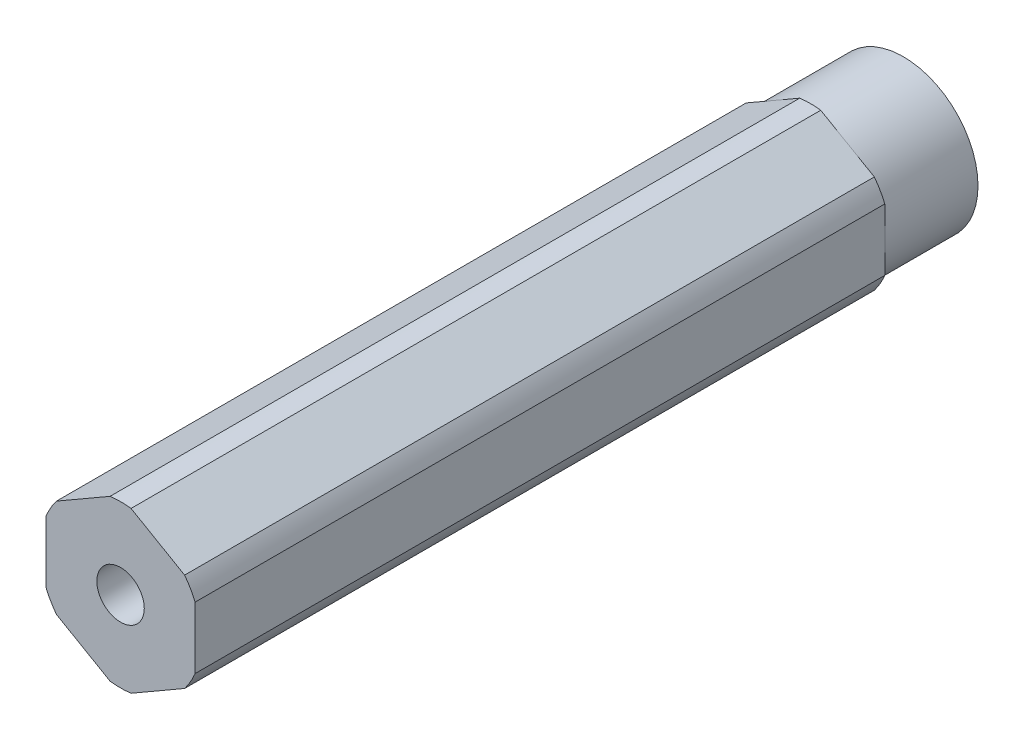
from build123d import *

# Parameters (mm, degrees)
BOSS_EXTRUDE1_DEPTH                  = 33.3375
SKETCH3_R                            = 2.0193
CUT_EXTRUDE1_DEPTH                   = 68.328625042
CUT_EXTRUDE3_START                   = -7.9375
SKETCH8_R                            = 6.875
SKETCH8_R_2                          = 6.35
CUT_EXTRUDE3_DEPTH                   = 7.9375
F_10_32_TAPPED_HOLE1_D               = 4.0386
F_10_32_TAPPED_HOLE1_DEPTH           = 12.02944
F_10_32_TAPPED_HOLE1_TIP             = 1.213317848
F_10_32_TAPPED_HOLE1_ON_FACE_2_D     = 4.0386
F_10_32_TAPPED_HOLE1_ON_FACE_2_DEPTH = 12.02944
F_10_32_TAPPED_HOLE1_ON_FACE_2_TIP   = 1.213317848


with BuildPart() as part:
    # Sketch1 → Boss-Extrude1 (new, symmetric)
    with BuildSketch(Plane.XY):
        with BuildLine():
            Line((-0.893039494, 6.816751826), (-5.456960506, 4.181770802))
            ThreePointArc((-5.456960506, 4.181770802), (-5.953924651, 3.4375), (-6.35, 2.634981025))
            Line((-6.35, 2.634981025), (-6.35, -2.634981025))
            ThreePointArc((-6.35, -2.634981025), (-5.953924651, -3.4375), (-5.456960506, -4.181770802))
            Line((-5.456960506, -4.181770802), (-0.893039494, -6.816751826))
            ThreePointArc((-0.893039494, -6.816751826), (0, -6.875), (0.893039494, -6.816751826))
            Line((0.893039494, -6.816751826), (5.456960506, -4.181770802))
            ThreePointArc((5.456960506, -4.181770802), (5.953924651, -3.4375), (6.35, -2.634981025))
            Line((6.35, -2.634981025), (6.35, 2.634981025))
            ThreePointArc((6.35, 2.634981025), (5.953924651, 3.4375), (5.456960506, 4.181770802))
            Line((5.456960506, 4.181770802), (0.893039494, 6.816751826))
            ThreePointArc((0.893039494, 6.816751826), (0, 6.875), (-0.893039494, 6.816751826))
        make_face()
    extrude(amount=BOSS_EXTRUDE1_DEPTH, both=True)

    # Sketch3 → Cut-Extrude1 (cut, through all)
    with BuildSketch(Plane.XY.offset(33.3375)):
        Circle(SKETCH3_R)
    extrude(amount=-CUT_EXTRUDE1_DEPTH, mode=Mode.SUBTRACT)

    # Sketch8 → Cut-Extrude3 (cut)
    with BuildSketch(Plane(origin=(0, 0, -33.3375), x_dir=(-1, 0, 0), z_dir=(0, 0, -1)).offset(CUT_EXTRUDE3_START)):
        Circle(SKETCH8_R)
        with Locations(Location((0, 0, 0), (0, 0, 180))):
            Circle(SKETCH8_R_2, mode=Mode.SUBTRACT)
    extrude(amount=CUT_EXTRUDE3_DEPTH, mode=Mode.SUBTRACT)

    # #10-32 Tapped Hole1
    with Locations(Plane(origin=(0, 0, -33.3375), x_dir=(-1, 0, 0), z_dir=(0, 0, -1))):
        with Locations((0, 0)):
            Hole(F_10_32_TAPPED_HOLE1_D / 2, depth=F_10_32_TAPPED_HOLE1_DEPTH)
            with Locations((0, 0, -(F_10_32_TAPPED_HOLE1_DEPTH + F_10_32_TAPPED_HOLE1_TIP / 2))):  # 118° drill point
                Cone(0, F_10_32_TAPPED_HOLE1_D / 2, F_10_32_TAPPED_HOLE1_TIP, mode=Mode.SUBTRACT)

    # #10-32 Tapped Hole1 on face 2
    with Locations(Plane(origin=(0, 0, 33.3375), x_dir=(-1, 0, 0), z_dir=(0, 0, -1))):
        with Locations((0, 0)):
            Hole(F_10_32_TAPPED_HOLE1_ON_FACE_2_D / 2, depth=F_10_32_TAPPED_HOLE1_ON_FACE_2_DEPTH)
            with Locations((0, 0, -(F_10_32_TAPPED_HOLE1_ON_FACE_2_DEPTH + F_10_32_TAPPED_HOLE1_ON_FACE_2_TIP / 2))):  # 118° drill point
                Cone(0, F_10_32_TAPPED_HOLE1_ON_FACE_2_D / 2, F_10_32_TAPPED_HOLE1_ON_FACE_2_TIP, mode=Mode.SUBTRACT)


solid = part.part
